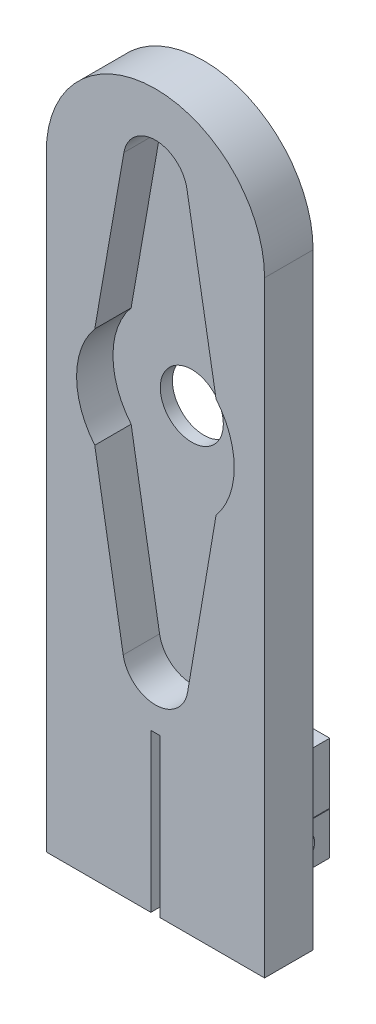
from build123d import *

# Parameters (mm, degrees)
EXTRUDE_1_DEPTH          = 4
CUT_EXTRUDE_1_DEPTH      = 3
CUT_EXTRUDE_9_DEPTH      = 19
CUT_EXTRUDE_9_DEPTH_BACK = 2
SKETCH_4_R               = 2.6
SKETCH_5_W               = 0.75
SKETCH_5_H               = 13
CUT_EXTRUDE_11_DEPTH     = 60.816385715
SKETCH_8_W               = 5
SKETCH_8_H               = 5
EXTRUDE_2_DEPTH          = 5
SKETCH_9_R               = 1.25
CUT_EXTRUDE_12_DEPTH     = 39
SKETCH_11_W              = 5
SKETCH_11_H              = 3.5
SKETCH_11_R              = 1.25
EXTRUDE_4_DEPTH          = 5


with BuildPart() as part:
    # 草圖1 → 填料-伸長1 (new body)
    with BuildSketch(Plane.XY):
        with BuildLine():
            Line((-9, 0), (-9, 50))
            ThreePointArc((-9, 50), (0, 59), (9, 50))
            Line((9, 50), (9, 0))
            Line((9, 0), (-9, 0))
        make_face()
    extrude(amount=EXTRUDE_1_DEPTH)

    # 草圖2 → 除料-伸長1 (cut)
    with BuildSketch(Plane.XY.offset(4)):
        with BuildLine():
            Line((-2.6, 53.145110573), (-5, 39.352358854))
            ThreePointArc((-5, 39.352358854), (-6.5, 35.199046922), (-5, 31.045734991))
            Line((-5, 31.045734991), (-2.656326538, 17.243300615))
            ThreePointArc((-2.656326538, 17.243300615), (0, 15), (2.656326538, 17.243300615))
            Line((2.656326538, 17.243300615), (5, 31.045734991))
            ThreePointArc((5, 31.045734991), (6.5, 35.199046922), (5, 39.352358854))
            Line((5, 39.352358854), (2.6, 53.145110573))
            ThreePointArc((2.6, 53.145110573), (0, 55.331766334), (-2.6, 53.145110573))
        make_face()
    extrude(amount=-CUT_EXTRUDE_1_DEPTH, mode=Mode.SUBTRACT)

    # 草圖4 → 除料-伸長9 (cut, two sides: drawn at the far end of the back side and taken through both)
    with BuildSketch(Plane.XY.offset(-CUT_EXTRUDE_9_DEPTH_BACK)):
        with Locations(Location((0, 34.856314216, 0), (0, 0, 180))):
            Circle(SKETCH_4_R)
    extrude(amount=CUT_EXTRUDE_9_DEPTH + CUT_EXTRUDE_9_DEPTH_BACK, mode=Mode.SUBTRACT)

    # 草圖5 → 除料-伸長11 (cut, through all)
    with BuildSketch(Plane.XY):
        with Locations((0, 6.5)):
            Rectangle(SKETCH_5_W, SKETCH_5_H)
    extrude(amount=CUT_EXTRUDE_11_DEPTH, mode=Mode.SUBTRACT)

    # 草圖8 → 填料-伸長2 (add)
    with BuildSketch(Plane.XY):
        with Locations((2.875, 8.312164066)):
            Rectangle(SKETCH_8_W, SKETCH_8_H)
    extrude(amount=-EXTRUDE_2_DEPTH)

    # 草圖9 → 除料-伸長12 (cut)
    with BuildSketch(Plane(origin=(0, 0, 0), x_dir=(0, 0, -1), z_dir=(1, 0, 0))):
        with Locations(Location((2.379774756, 8.312164066, 0), (0, 0, 180))):
            Circle(SKETCH_9_R)
    extrude(amount=CUT_EXTRUDE_12_DEPTH, mode=Mode.SUBTRACT)

    # 草圖11 → 填料-伸長4 (add)
    with BuildSketch(Plane(origin=(0.375, 0, 0), x_dir=(0, 0, -1), z_dir=(1, 0, 0))):
        with Locations((2.5, 4.012164066)):
            Rectangle(SKETCH_11_W, SKETCH_11_H)
        with Locations((2.5, 4.012164066)):
            Circle(SKETCH_11_R, mode=Mode.SUBTRACT)
    extrude(amount=EXTRUDE_4_DEPTH)


solid = part.part
